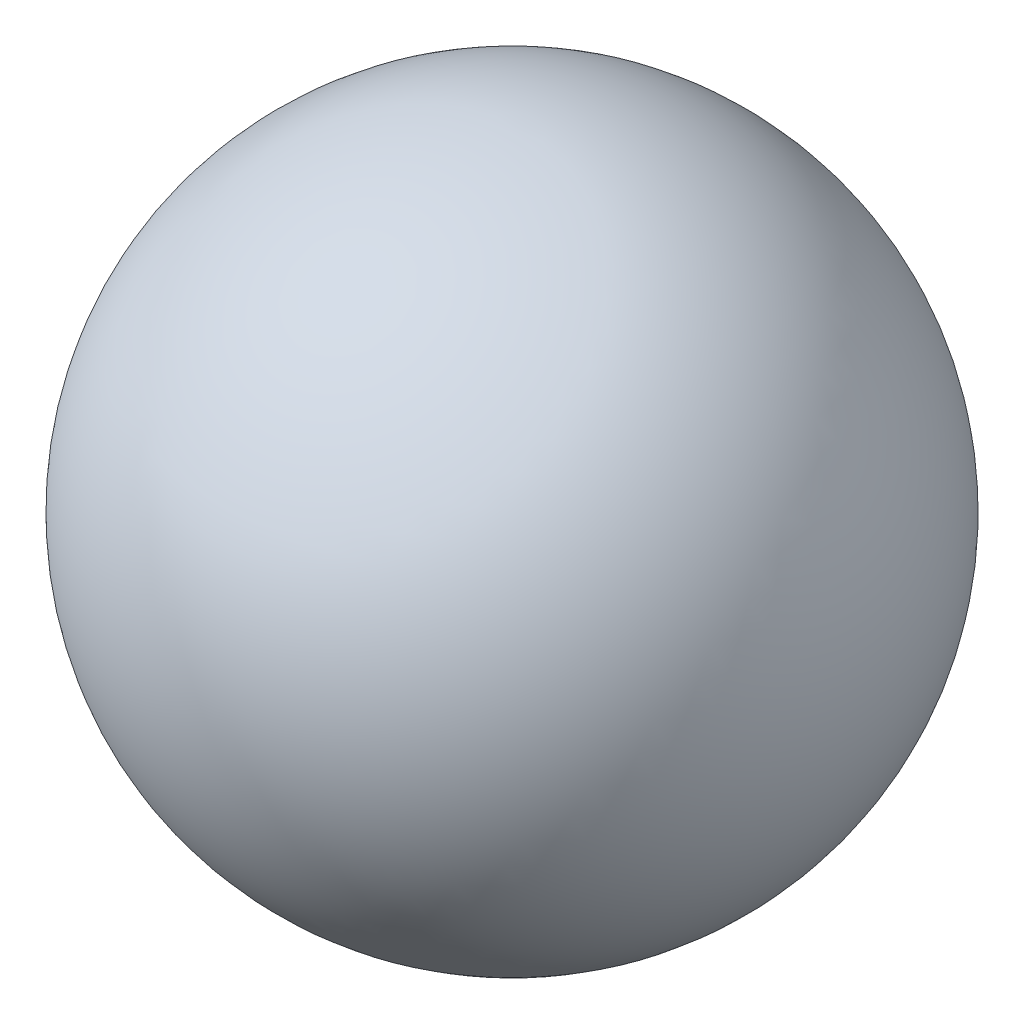
from build123d import *

# Parameters (mm, degrees)
CUT_EXTRUDE1_DEPTH      = 35.641016151
CUT_EXTRUDE1_DEPTH_BACK = 35.641016151
M10_TAPPED_HOLE1_D      = 8.5
M10_TAPPED_HOLE1_DEPTH  = 10
M10_TAPPED_HOLE1_TIP    = 2.553657631


with BuildPart() as part:
    # Sketch1 → Revolve2 (revolve)
    with BuildSketch(Plane.XY):
        with BuildLine():
            Line((0, 20), (0, -20))
            ThreePointArc((0, -20), (20, 0), (0, 20))
        make_face()
    revolve(axis=Axis((0, 20, 0), (0, -1, 0)))

    # Sketch2 → Cut-Extrude1 (cut, two sides: drawn at the far end of the back side and taken through both)
    with BuildSketch(Plane.XY.offset(-CUT_EXTRUDE1_DEPTH_BACK)):
        Polygon((-113.979792733, -18), (-8.717797887, -18), (8.717797887, -18), (113.979792733, -18), (113.979792733, -228.523989691), (-113.979792733, -228.523989691), align=None)
    extrude(amount=CUT_EXTRUDE1_DEPTH + CUT_EXTRUDE1_DEPTH_BACK, mode=Mode.SUBTRACT)

    # M10 Tapped Hole1
    with Locations(Plane(origin=(0, -18, 0), x_dir=(-1, 0, 0), z_dir=(0, -1, 0))):
        with Locations((0, 0)):
            Hole(M10_TAPPED_HOLE1_D / 2, depth=M10_TAPPED_HOLE1_DEPTH)
            with Locations((0, 0, -(M10_TAPPED_HOLE1_DEPTH + M10_TAPPED_HOLE1_TIP / 2))):  # 118° drill point
                Cone(0, M10_TAPPED_HOLE1_D / 2, M10_TAPPED_HOLE1_TIP, mode=Mode.SUBTRACT)


solid = part.part
